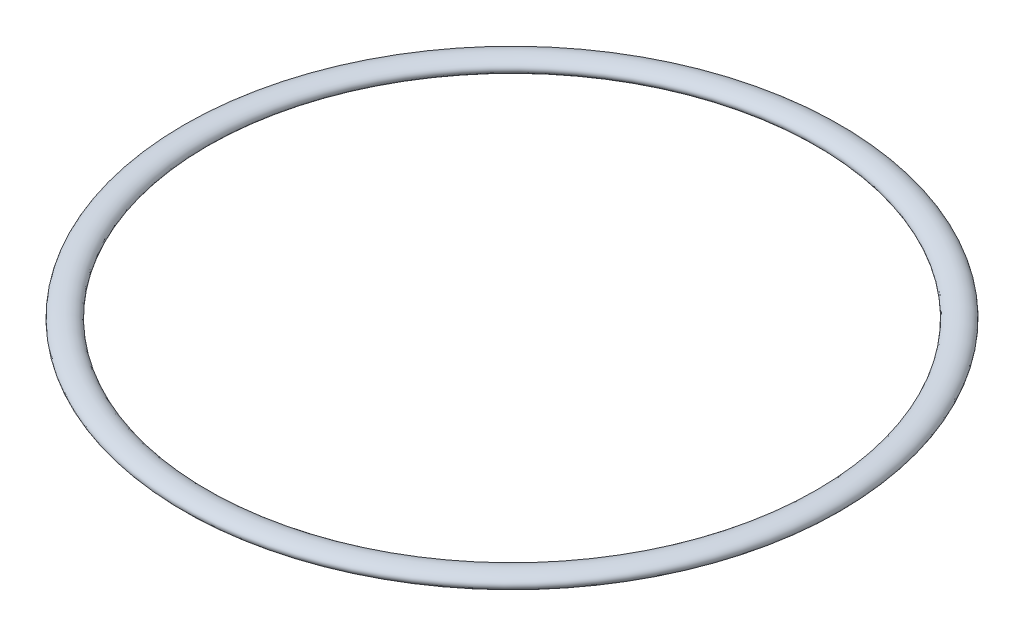
from build123d import *

# Parameters (mm, degrees)
RECONSTRUCTED_NOMINAL_AXIAL_PROFILE_RX = 1.361231489
RECONSTRUCTED_NOMINAL_AXIAL_PROFILE_RY = 0.725


with BuildPart() as part:
    # Reconstructed nominal axial profile → Native revolved geometry (revolve)
    with BuildSketch(Plane.XY):
        with Locations((32.425, 0)):
            Ellipse(RECONSTRUCTED_NOMINAL_AXIAL_PROFILE_RX, RECONSTRUCTED_NOMINAL_AXIAL_PROFILE_RY)
    revolve(axis=Axis((0, -500, 0), (0, 1, 0)))


solid = part.part
